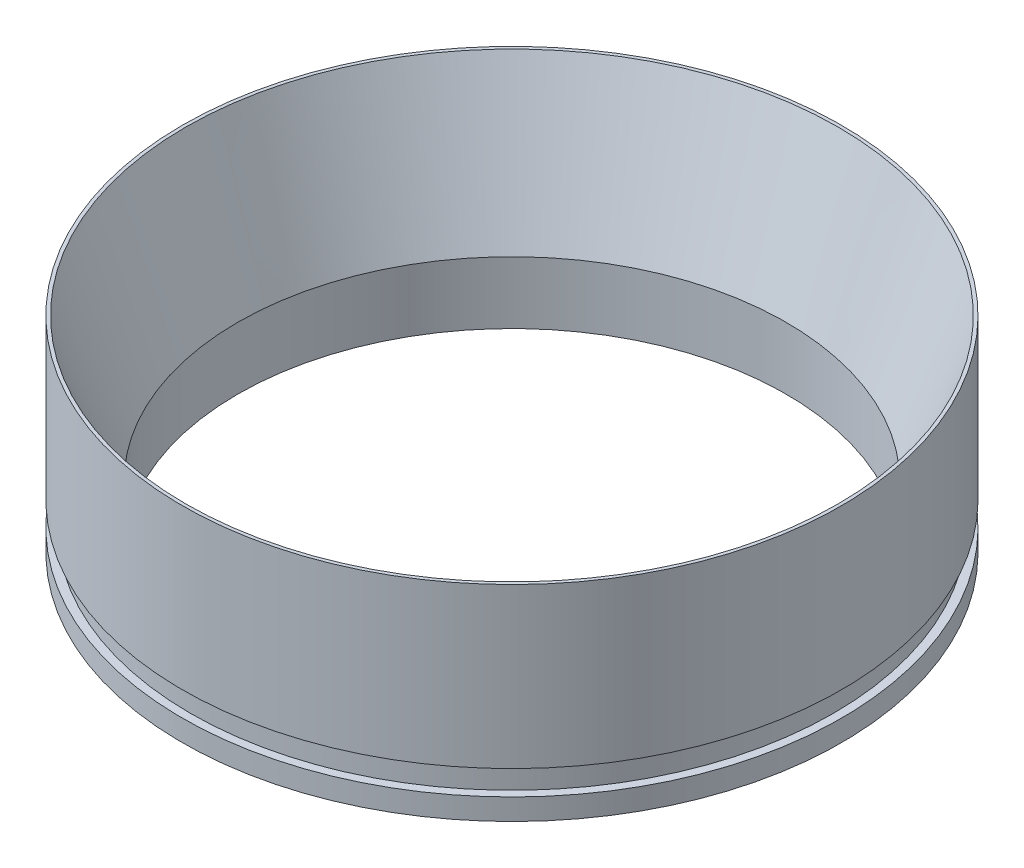
from build123d import *


with BuildPart() as part:
    # Sketch1 → Revolve1 (revolve)
    with BuildSketch(Plane.XY, mode=Mode.PRIVATE) as revolve1_sk:
        Polygon((42.545, 9.652), (50.6222, 31.843924612), (51.1302, 31.843924612), (51.1302, 7.112), (49.8602, 7.112), (49.8602, 3.302), (51.1302, 3.302), (51.1302, 0), (42.545, 0), align=None)
    revolve(revolve1_sk.sketch.rotate(Axis((0, 33.239643142, 0), (0, -1, 0)), 180), axis=Axis((0, 33.239643142, 0), (0, -1, 0)))


solid = part.part
